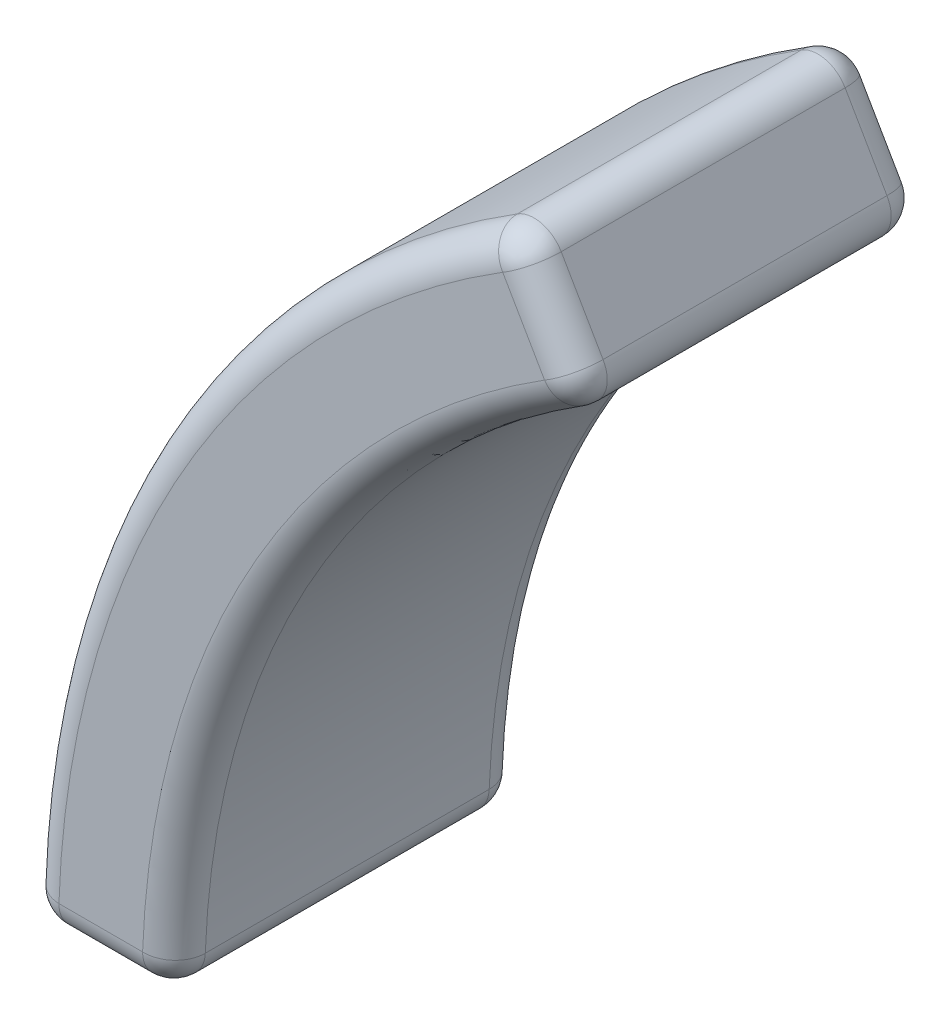
from build123d import *

# Parameters (mm, degrees)
BOSS_EXTRUDE1_DEPTH = 331.6
FILLET1_R           = 30


with BuildPart() as part:
    # Sketch1 → Boss-Extrude1 (new body)
    with BuildSketch(Plane.XY):
        with BuildLine():
            Line((-791.6, 0), (-931.6, 0))
            ThreePointArc((-931.6, 0), (-806.789266166, 465.8), (-465.8, 806.789266166))
            Line((-465.8, 806.789266166), (-395.8, 685.545709636))
            ThreePointArc((-395.8, 685.545709636), (-685.545709636, 395.8), (-791.6, 0))
        make_face()
    extrude(amount=-BOSS_EXTRUDE1_DEPTH)

    # Fillet1
    fillet1_edges = [part.edges().sort_by_distance(p)[0] for p in [
        (-806.789266166, 465.8, -331.6),
        (-861.6, 0, -331.6),
        (-685.545709636, 395.8, -331.6),
        (-861.6, 0, 0),
        (-806.789266166, 465.8, 0),
        (-430.8, 746.167487901, 0),
        (-685.545709636, 395.8, 0),
        (-791.6, 0, -165.8),
        (-931.6, 0, -165.8),
        (-465.8, 806.789266166, -165.8),
        (-395.8, 685.545709636, -165.8),
        (-430.8, 746.167487901, -331.6),
    ]]
    fillet(fillet1_edges, radius=FILLET1_R)


solid = part.part
